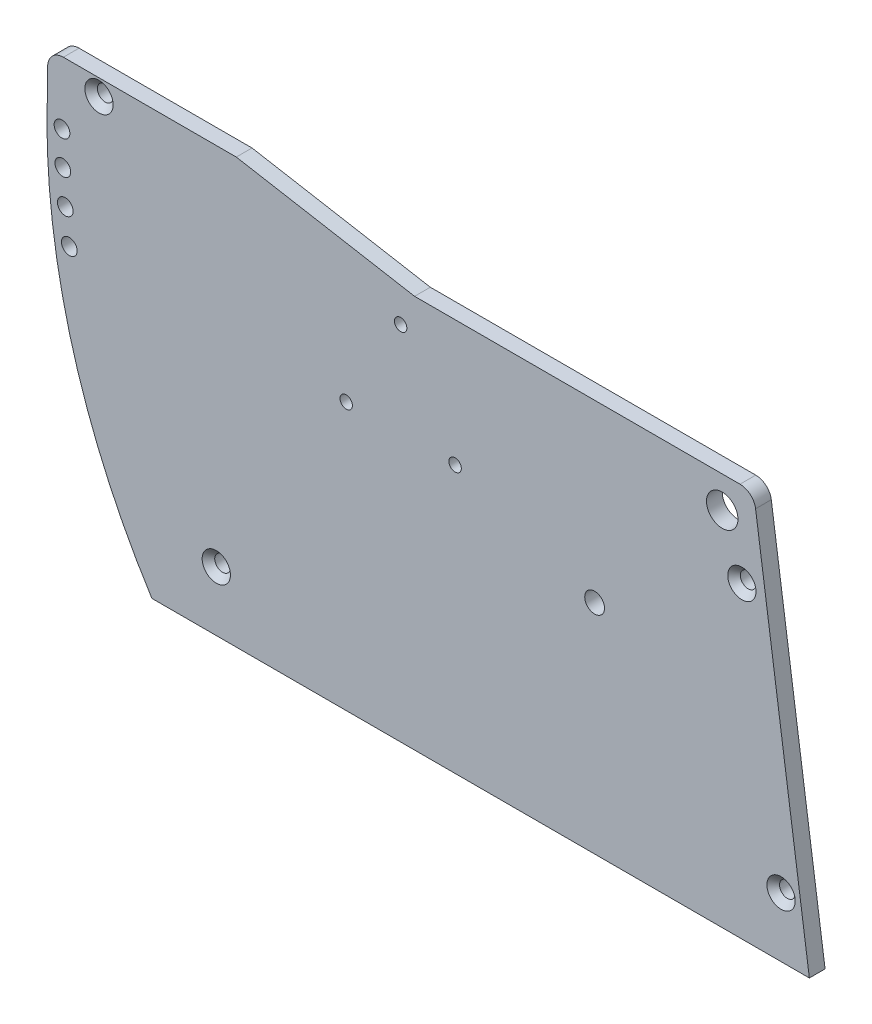
from build123d import *

# Parameters (mm, degrees)
SKETCH18_R          = 3.175
SKETCH18_R_2        = 6.35
SKETCH18_R_3        = 2.5019
BOSS_EXTRUDE4_DEPTH = 6.35
CHAMFER1_SIZE       = 2.54
SKETCH19_R          = 4
CUT_EXTRUDE1_DEPTH  = 43.434


with BuildPart() as part:
    # Sketch18 → Boss-Extrude4 (new body)
    with BuildSketch(Plane.XY):
        with BuildLine():
            Line((0, 0), (-265.604745697, 0))
            ThreePointArc((-265.604745697, 0), (-298.882523776, 76.131915965), (-307.699061234, 158.75))
            Line((-307.699061234, 158.75), (-307.699061234, 165.1))
            ThreePointArc((-307.699061234, 165.1), (-305.839189294, 169.590128061), (-301.349061234, 171.45))
            Line((-301.349061234, 171.45), (-231.499061234, 171.45))
            Line((-231.499061234, 171.45), (-159.473782125, 158.75))
            Line((-159.473782125, 158.75), (-28.014368889, 158.75))
            ThreePointArc((-28.014368889, 158.75), (-23.851207857, 157.194850386), (-21.727208485, 153.291130779))
            Line((-21.727208485, 153.291130779), (0, 0))
        make_face()
        with Locations((-11.423473622, 24.034728138)):
            Circle(SKETCH18_R, mode=Mode.SUBTRACT)
        with Locations((-27.253356194, 124.406511892)):
            Circle(SKETCH18_R, mode=Mode.SUBTRACT)
        with Locations((-35.200938766, 146.05)):
            Circle(SKETCH18_R_2, mode=Mode.SUBTRACT)
        with Locations((-301.900938766, 146.05)):
            Circle(SKETCH18_R, mode=Mode.SUBTRACT)
        with Locations((-301.569673588, 132.761391752)):
            Circle(SKETCH18_R, mode=Mode.SUBTRACT)
        with Locations((-300.579872803, 119.537524267)):
            Circle(SKETCH18_R, mode=Mode.SUBTRACT)
        with Locations((-298.943543444, 106.442822899)):
            Circle(SKETCH18_R, mode=Mode.SUBTRACT)
        with Locations((-239.568937637, 24.034728138)):
            Circle(SKETCH18_R, mode=Mode.SUBTRACT)
        with Locations((-286.962142025, 164.850708953)):
            Circle(SKETCH18_R, mode=Mode.SUBTRACT)
        with Locations((-165.1, 146.05)):
            Circle(SKETCH18_R_3, mode=Mode.SUBTRACT)
        with Locations((-143.102954744, 107.95)):
            Circle(SKETCH18_R_3, mode=Mode.SUBTRACT)
        with Locations((-187.097045256, 107.95)):
            Circle(SKETCH18_R_3, mode=Mode.SUBTRACT)
    extrude(amount=BOSS_EXTRUDE4_DEPTH)

    # Chamfer1
    chamfer1_edges = [part.edges().sort_by_distance(p)[0] for p in [
        (-14.598473622, 24.034728138, 6.35),
        (-30.428356194, 124.406511892, 6.35),
        (-242.743937637, 24.034728138, 6.35),
        (-290.137142025, 164.850708953, 6.35),
    ]]
    chamfer(chamfer1_edges, length=CHAMFER1_SIZE)

    # Sketch19 → Cut-Extrude1 (cut)
    with BuildSketch(Plane(origin=(0, 0, 0), x_dir=(-1, 0, 0), z_dir=(0, 0, -1))):
        with Locations((86.747156029, 87.953133026)):
            Circle(SKETCH19_R)
    extrude(amount=-CUT_EXTRUDE1_DEPTH, mode=Mode.SUBTRACT)


solid = part.part
